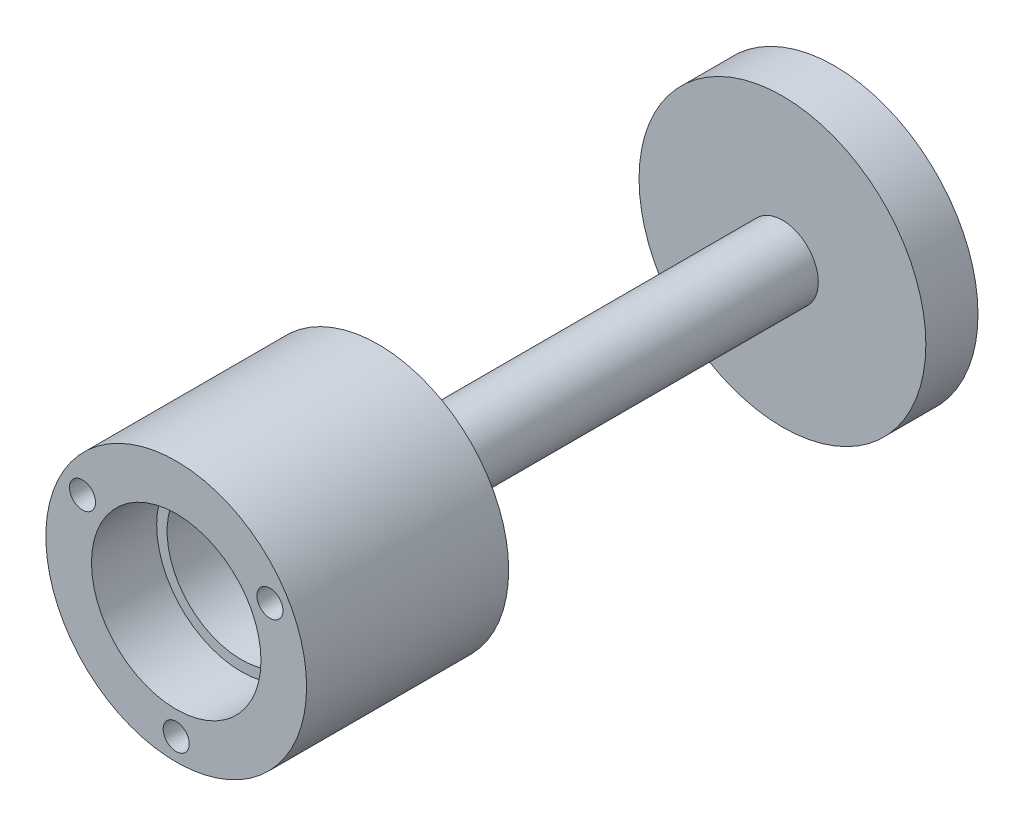
from build123d import *

# Parameters (mm, degrees)
MOUNTING_FLANGE_START                          = -4
SKETCH1_R                                      = 11
MOUNTING_FLANGE_DEPTH                          = 4
SKETCH2_R                                      = 2.75
D5P5_CENTRAL_POST_DEPTH                        = 31.01
CLOSED_FLOOR_BELOW_SHAFT_NOSE_START            = 31
SKETCH3_R                                      = 10
CLOSED_FLOOR_BELOW_SHAFT_NOSE_DEPTH            = 2
SHAFT_AND_CLIP_CLEARANCE_START                 = 33
SKETCH4_R                                      = 10
SKETCH4_R_2                                    = 5.7
SHAFT_AND_CLIP_CLEARANCE_DEPTH                 = 8.5
LOWER_686ZZ_SEAT_START                         = 41.5
SKETCH5_R                                      = 10
SKETCH5_R_2                                    = 6.5
LOWER_686ZZ_SEAT_DEPTH                         = 5
SKETCH6_R                                      = 1
BASE_THREE_M2_BLIND_THREAD_MAJOR_ENVELOP_DEPTH = 3.6
TOP_CAP_THREE_M2_BLIND_THREAD_MAJOR_ENVE_START = -4.3
SKETCH7_R                                      = 1
TOP_CAP_THREE_M2_BLIND_THREAD_MAJOR_ENVE_DEPTH = 4.3


with BuildPart() as part:
    # Sketch1 → Mounting_Flange (new body)
    with BuildSketch(Plane.XY.offset(MOUNTING_FLANGE_START)):
        Circle(SKETCH1_R)
    extrude(amount=MOUNTING_FLANGE_DEPTH)

    # Sketch2 → D5p5_Central_Post (add)
    with BuildSketch(Plane.XY):
        Circle(SKETCH2_R)
    extrude(amount=D5P5_CENTRAL_POST_DEPTH)

    # Sketch3 → Closed_Floor_Below_Shaft_Nose (add)
    with BuildSketch(Plane.XY.offset(CLOSED_FLOOR_BELOW_SHAFT_NOSE_START)):
        Circle(SKETCH3_R)
    extrude(amount=CLOSED_FLOOR_BELOW_SHAFT_NOSE_DEPTH)

    # Sketch4 → Shaft_And_Clip_Clearance (add)
    with BuildSketch(Plane.XY.offset(SHAFT_AND_CLIP_CLEARANCE_START)):
        Circle(SKETCH4_R)
        Circle(SKETCH4_R_2, mode=Mode.SUBTRACT)
    extrude(amount=SHAFT_AND_CLIP_CLEARANCE_DEPTH)

    # Sketch5 → Lower_686ZZ_Seat (add)
    with BuildSketch(Plane.XY.offset(LOWER_686ZZ_SEAT_START)):
        Circle(SKETCH5_R)
        Circle(SKETCH5_R_2, mode=Mode.SUBTRACT)
    extrude(amount=LOWER_686ZZ_SEAT_DEPTH)

    # Sketch6 → Base_Three_M2_Blind_Thread_Major_Envelopes (cut)
    with BuildSketch(Plane(origin=(0, 0, -4), x_dir=(-1, 0, 0), z_dir=(0, 0, -1))):
        with Locations((-7.188010851, 4.15)):
            Circle(SKETCH6_R)
        with Locations((7.188010851, 4.15)):
            Circle(SKETCH6_R)
        with Locations((0, -8.3)):
            Circle(SKETCH6_R)
    extrude(amount=-BASE_THREE_M2_BLIND_THREAD_MAJOR_ENVELOP_DEPTH, mode=Mode.SUBTRACT)

    # Sketch7 → Top_Cap_Three_M2_Blind_Thread_Major_Envelopes (cut)
    with BuildSketch(Plane.XY.offset(46.5).offset(TOP_CAP_THREE_M2_BLIND_THREAD_MAJOR_ENVE_START)):
        with Locations(Location((7.188010851, 4.15, 0), (0, 0, 180))):
            Circle(SKETCH7_R)
        with Locations(Location((-7.188010851, 4.15, 0), (0, 0, 180))):
            Circle(SKETCH7_R)
        with Locations(Location((0, -8.3, 0), (0, 0, 180))):
            Circle(SKETCH7_R)
    extrude(amount=TOP_CAP_THREE_M2_BLIND_THREAD_MAJOR_ENVE_DEPTH, mode=Mode.SUBTRACT)


solid = part.part
